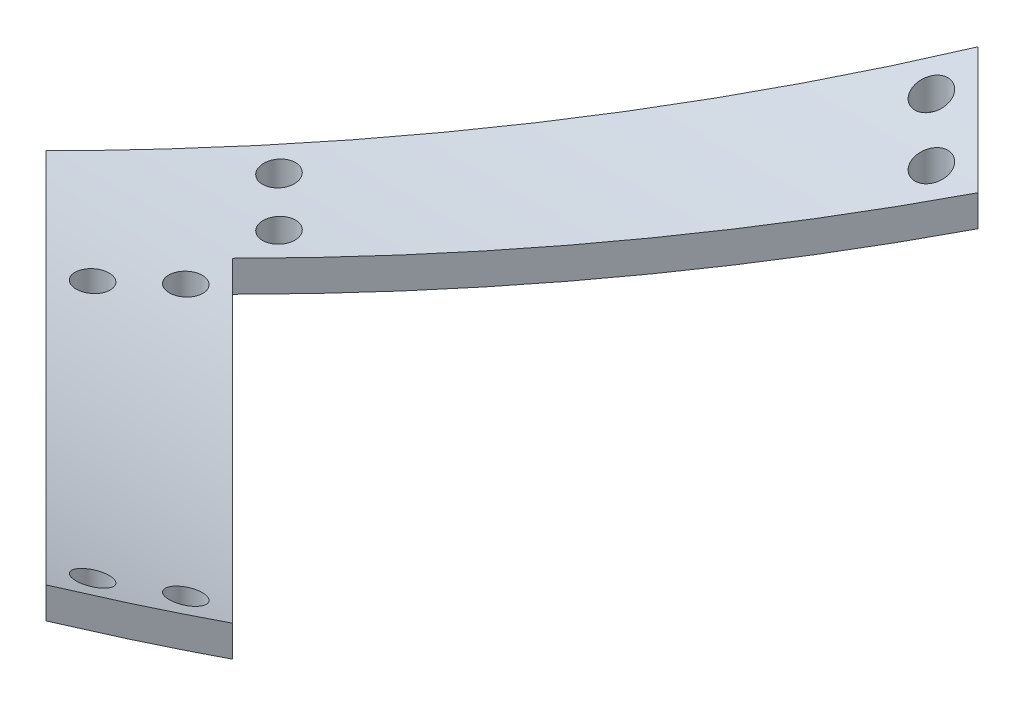
from build123d import *

# Parameters (mm, degrees)
BOSS_EXTRUDE4_DEPTH = 304.8
SKETCH4_OUTSIDE_W   = 384.928
SKETCH4_OUTSIDE_H   = 321.428
CUT_EXTRUDE2_DEPTH  = 150
SKETCH6_R           = 3.175
CUT_EXTRUDE3_DEPTH  = 150


with BuildPart() as part:
    # Sketch3 → Boss-Extrude4 (new body)
    with BuildSketch(Plane(origin=(0, 0, 0), x_dir=(0, 0, -1), z_dir=(1, 0, 0))):
        with BuildLine():
            ThreePointArc((232.90669496, 1.961354585), (112.25669496, -30.366715482), (-8.39330504, 1.961354585))
            Line((-8.39330504, 1.961354585), (-8.39330504, -4.052041589))
            ThreePointArc((-8.39330504, -4.052041589), (112.25669496, -36.380111656), (232.90669496, -4.052041589))
            Line((232.90669496, -4.052041589), (232.90669496, 1.961354585))
        make_face()
    extrude(amount=BOSS_EXTRUDE4_DEPTH)

    # Sketch4 outside → Cut-Extrude2 (cut)
    with BuildSketch(Plane(origin=(0, 1.961354585, 0), x_dir=(1, 0, 0), z_dir=(0, 1, 0))):
        with Locations((152.4, 112.257)):
            Rectangle(SKETCH4_OUTSIDE_W, SKETCH4_OUTSIDE_H)
        Polygon((123.316822566, 202.059214397), (33.514261355, 112.256736733), (123.316822566, 22.454175523), (141.277334808, 40.414687765), (69.435327613, 112.25669496), (141.277334808, 184.098702154), align=None, mode=Mode.SUBTRACT)
    extrude(amount=-CUT_EXTRUDE2_DEPTH, mode=Mode.SUBTRACT)

    # Sketch6 → Cut-Extrude3 (cut)
    with BuildSketch(Plane(origin=(0, 1.961354585, 0), x_dir=(1, 0, 0), z_dir=(0, 1, 0))):
        with Locations(Location((123.316821174, 193.078955491, 0), (0, 0, 270))):
            Circle(SKETCH6_R)
        with Locations(Location((132.297078687, 184.098700762, 0), (0, 0, 270))):
            Circle(SKETCH6_R)
        with Locations(Location((60.455057568, 130.217250368, 0), (0, 0, 270))):
            Circle(SKETCH6_R)
        with Locations(Location((69.435303942, 121.2369845, 0), (0, 0, 270))):
            Circle(SKETCH6_R)
        with Locations(Location((132.296911593, 40.41454295, 0), (0, 0, 270))):
            Circle(SKETCH6_R)
        with Locations(Location((123.316633192, 31.434309108, 0), (0, 0, 270))):
            Circle(SKETCH6_R)
        with Locations(Location((60.455015794, 94.296160438, 0), (0, 0, 270))):
            Circle(SKETCH6_R)
        with Locations(Location((69.435283055, 103.27640542, 0), (0, 0, 270))):
            Circle(SKETCH6_R)
    extrude(amount=-CUT_EXTRUDE3_DEPTH, mode=Mode.SUBTRACT)


solid = part.part
